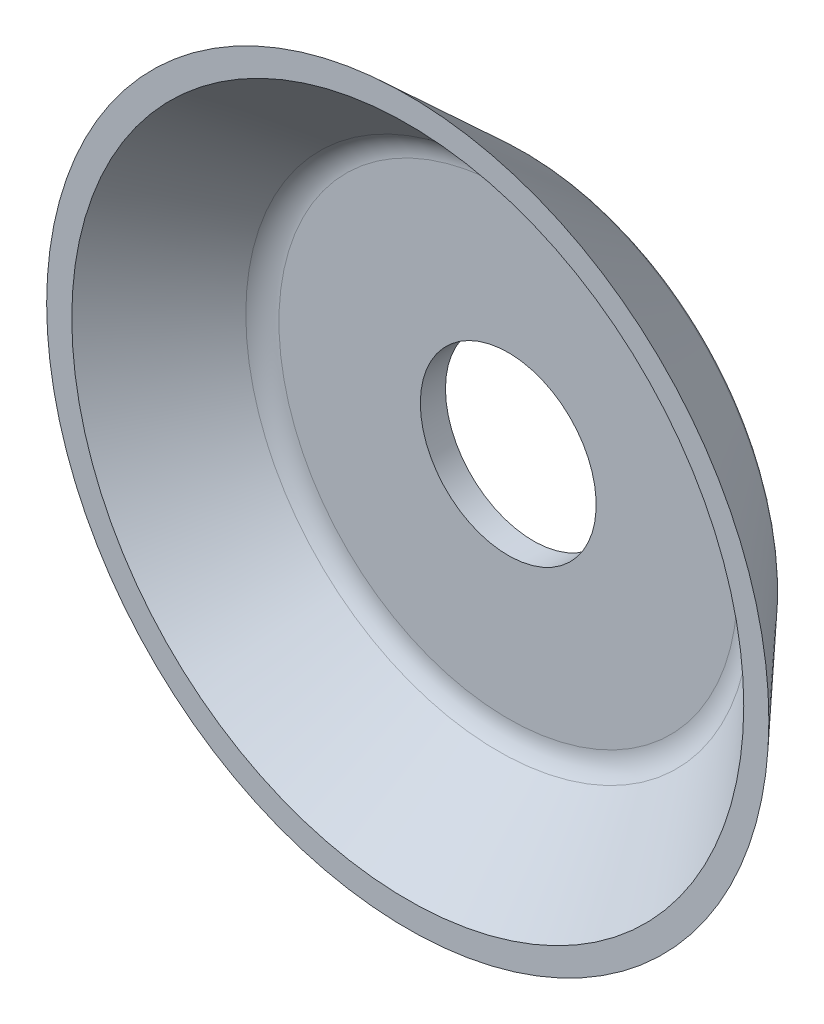
from build123d import *

# Parameters (mm, degrees)
FILLET_1_R = 1


with BuildPart() as part:
    # Эскиз4 → Повернуть1 (revolve)
    with BuildSketch(Plane(origin=(0, 0, 0), x_dir=(0, 0, -1), z_dir=(1, 0, 0)), mode=Mode.PRIVATE) as revolve_1_sk:
        Polygon((0, 2.8), (0, 7.8), (-4, 11.5), (-4, 10.7), (-0.8, 7.74), (-0.8, 2.8), align=None)
    revolve(revolve_1_sk.sketch.rotate(Axis((0, 0, 0), (0, 0, 1)), 90), axis=Axis((0, 0, 0), (0, 0, 1)))

    # Скругление1
    fillet_1_edges = [part.edges().sort_by_distance(p)[0] for p in [
        (7.74, 0, 0.8),
        (7.8, 0, 0),
    ]]
    fillet(fillet_1_edges, radius=FILLET_1_R)


solid = part.part
